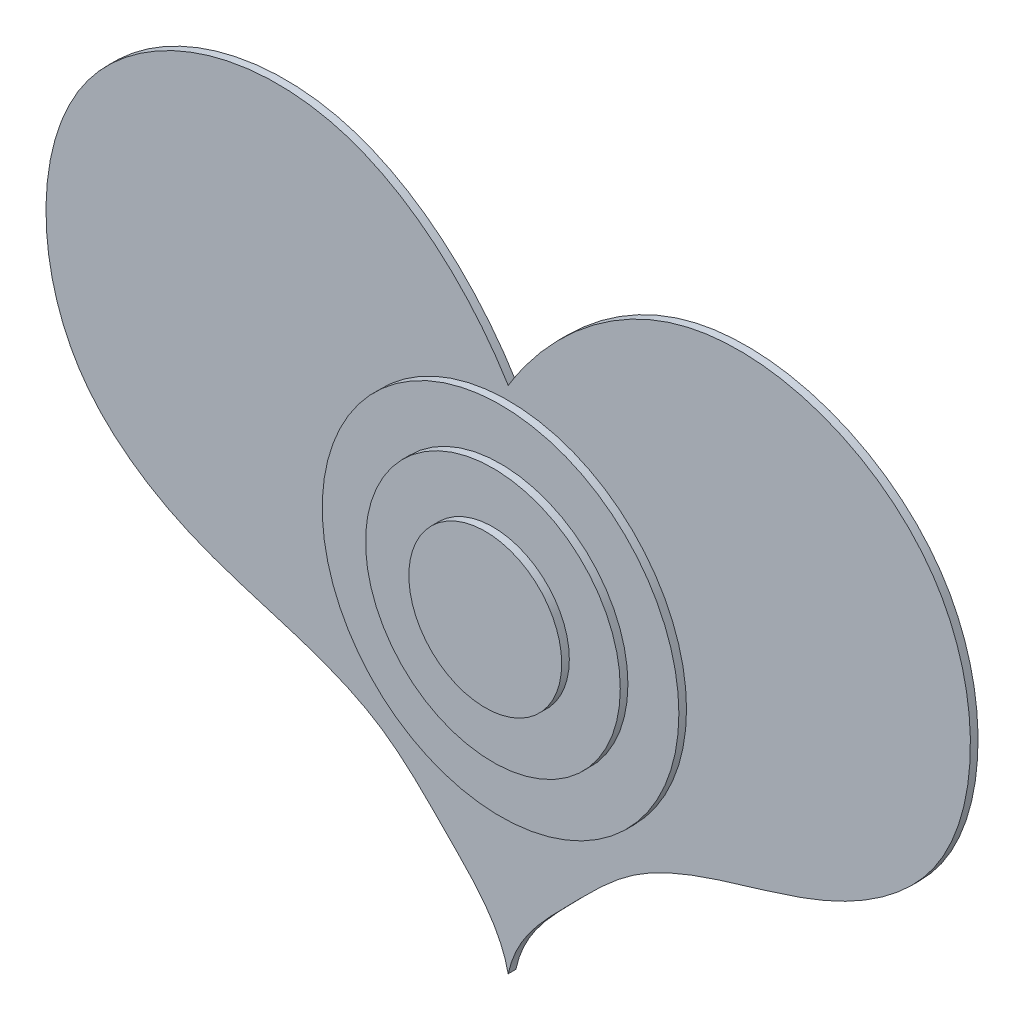
from build123d import *

# Parameters (mm, degrees)
BOSS_EXTRUDE2_DEPTH = 3
SKETCH4_R           = 70
BOSS_EXTRUDE3_DEPTH = 3
SKETCH6_R           = 50
BOSS_EXTRUDE4_DEPTH = 3
SKETCH7_R           = 30
BOSS_EXTRUDE5_DEPTH = 3


with BuildPart() as part:
    # Sketch3 → Boss-Extrude2 (new body)
    with BuildSketch(Plane.XY):
        with BuildLine():
            add(Edge.make_bspline(
                [(0, 94.186026498), (-14.937197001, 118.791774845), (-53.837629132, 154.385235119), (-123.714536571, 151.359453215), (-172.01966834, 117.463223927), (-186.123135767, 62.237600369), (-171.600514001, 9.539213873), (-129.602182184, -19.467929152), (-86.914362999, -30.595739372), (-49.13470838, -44.205541663), (-21.929171112, -72.883121261), (-3.141383744, -91.131398202), (0, -105.813973502)],
                knots=[0, 0, 0, 0, 0.172688092, 0.274912245, 0.387287087, 0.492001033, 0.588134212, 0.688255243, 0.771841292, 0.848466196, 0.917182163, 1, 1, 1, 1], degree=3))
            add(Edge.make_bspline(
                [(0, 94.186026498), (14.937197001, 118.791774845), (53.837629132, 154.385235119), (123.714536571, 151.359453215), (172.01966834, 117.463223927), (186.123135767, 62.237600369), (171.600514001, 9.539213873), (129.602182184, -19.467929152), (86.914362999, -30.595739372), (49.13470838, -44.205541663), (21.929171112, -72.883121261), (3.141383744, -91.131398202), (0, -105.813973502)],
                knots=[0, 0, 0, 0, 0.172688092, 0.274912245, 0.387287087, 0.492001033, 0.588134212, 0.688255243, 0.771841292, 0.848466196, 0.917182163, 1, 1, 1, 1], degree=3))
        make_face()
    extrude(amount=-BOSS_EXTRUDE2_DEPTH)

    # Sketch4 → Boss-Extrude3 (add)
    with BuildSketch(Plane.XY):
        with Locations((0, 19.111309062)):
            Circle(SKETCH4_R)
    extrude(amount=BOSS_EXTRUDE3_DEPTH)

    # Sketch6 → Boss-Extrude4 (add)
    with BuildSketch(Plane.XY.offset(3)):
        with Locations((0, 19.111309062)):
            Circle(SKETCH6_R)
    extrude(amount=BOSS_EXTRUDE4_DEPTH)

    # Sketch7 → Boss-Extrude5 (add)
    with BuildSketch(Plane.XY.offset(6)):
        with Locations((0, 19.111309062)):
            Circle(SKETCH7_R)
    extrude(amount=BOSS_EXTRUDE5_DEPTH)


solid = part.part
